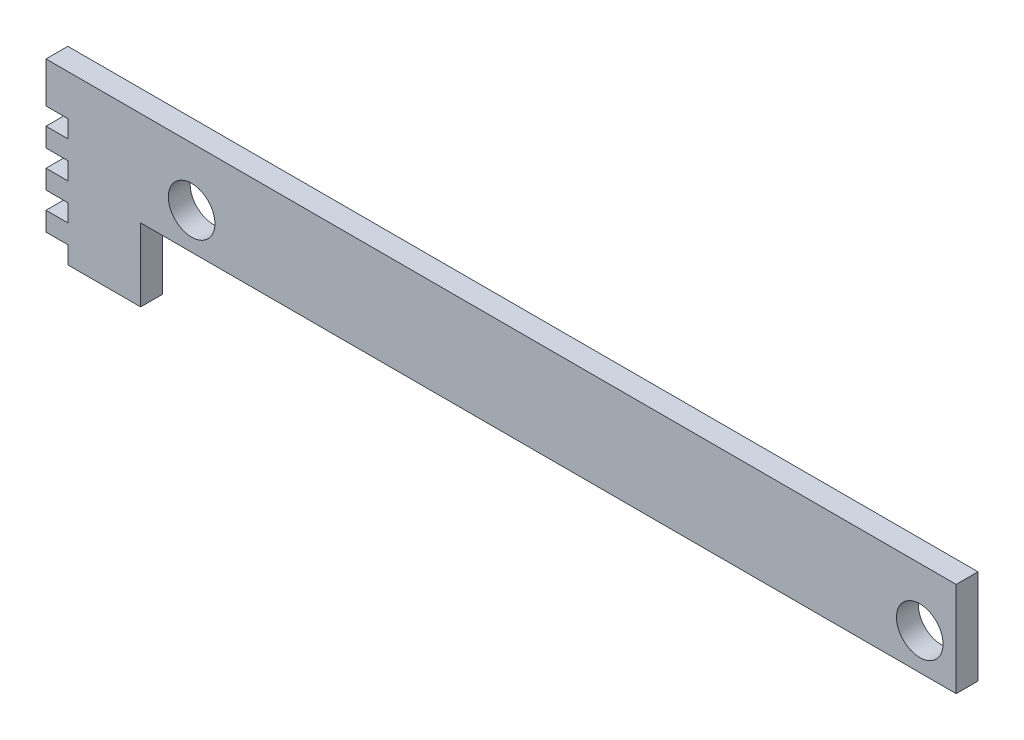
from build123d import *

# Parameters (mm, degrees)
ESQUISSE1_R        = 6.4
BOSS_EXTRU_1_DEPTH = 6


with BuildPart() as part:
    # Esquisse1 → Boss.-Extru.1 (new body)
    with BuildSketch(Plane.XY):
        Polygon((0, 0), (0, 26), (-250, 26), (-250, 20), (-250, 14.8), (-244, 14.8), (-244, 10), (-250, 10), (-250, 4.8), (-244, 4.8), (-244, 0), (-250, 0), (-250, -5.2), (-244, -5.2), (-244, -10), (-250, -10), (-250, -15.2), (-244, -15.2), (-244, -20), (-224, -20), (-224, 0), (-59.8, 0), align=None)
        with Locations((-210, 10)):
            Circle(ESQUISSE1_R, mode=Mode.SUBTRACT)
        with Locations((-10, 10)):
            Circle(ESQUISSE1_R, mode=Mode.SUBTRACT)
    extrude(amount=BOSS_EXTRU_1_DEPTH)


solid = part.part
